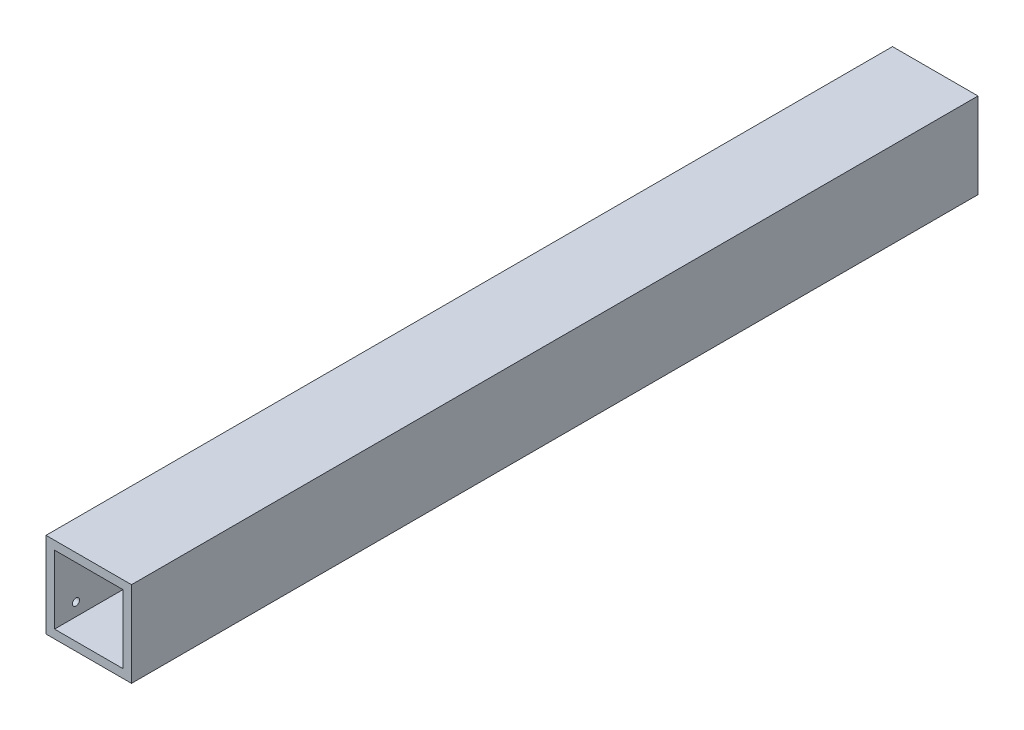
from build123d import *

# Parameters (mm, degrees)
SKETCH_1_W                  = 40
SKETCH_1_H                  = 40
SKETCH_1_W_2                = 32
SKETCH_1_H_2                = 32
EXTRUDE_1_DEPTH             = 396
HOLE_WIZARD_M61_D           = 5
HOLE_WIZARD_M61_DEPTH       = 17
HOLE_WIZARD_M61_CSINK_D     = 6.05
HOLE_WIZARD_M61_CSINK_ANGLE = 120
HOLE_WIZARD_M61_TIP         = 1.502151548
HOLE_WIZARD_M41_D           = 3.3
HOLE_WIZARD_M41_DEPTH       = 11.5
HOLE_WIZARD_M41_CSINK_D     = 4.05
HOLE_WIZARD_M41_CSINK_ANGLE = 120
HOLE_WIZARD_M41_TIP         = 0.991420021


with BuildPart() as part:
    # Эскиз1 → Вытянуть-Тонкостенный1 (new body)
    with BuildSketch(Plane.XY):
        with Locations((20, 20)):
            Rectangle(SKETCH_1_W, SKETCH_1_H)
        with Locations((20, 20)):
            Rectangle(SKETCH_1_W_2, SKETCH_1_H_2, mode=Mode.SUBTRACT)
    extrude(amount=EXTRUDE_1_DEPTH)

    # Отверстие обработанное метчиком M61
    with Locations(Plane.ZY):
        with Locations((30, 20), (80, 20), (130, 20), (180, 20), (230, 20), (280, 20), (330, 20)):
            CounterSinkHole(HOLE_WIZARD_M61_D / 2, HOLE_WIZARD_M61_CSINK_D / 2, depth=HOLE_WIZARD_M61_DEPTH, counter_sink_angle=HOLE_WIZARD_M61_CSINK_ANGLE)
            with Locations((0, 0, -(HOLE_WIZARD_M61_DEPTH + HOLE_WIZARD_M61_TIP / 2))):  # 118° drill point
                Cone(0, HOLE_WIZARD_M61_D / 2, HOLE_WIZARD_M61_TIP, mode=Mode.SUBTRACT)

    # Отверстие обработанное метчиком M41
    with Locations(Plane.ZY):
        with Locations((386, 10), (366, 10), (386, 30), (366, 30)):
            CounterSinkHole(HOLE_WIZARD_M41_D / 2, HOLE_WIZARD_M41_CSINK_D / 2, depth=HOLE_WIZARD_M41_DEPTH, counter_sink_angle=HOLE_WIZARD_M41_CSINK_ANGLE)
            with Locations((0, 0, -(HOLE_WIZARD_M41_DEPTH + HOLE_WIZARD_M41_TIP / 2))):  # 118° drill point
                Cone(0, HOLE_WIZARD_M41_D / 2, HOLE_WIZARD_M41_TIP, mode=Mode.SUBTRACT)


solid = part.part
